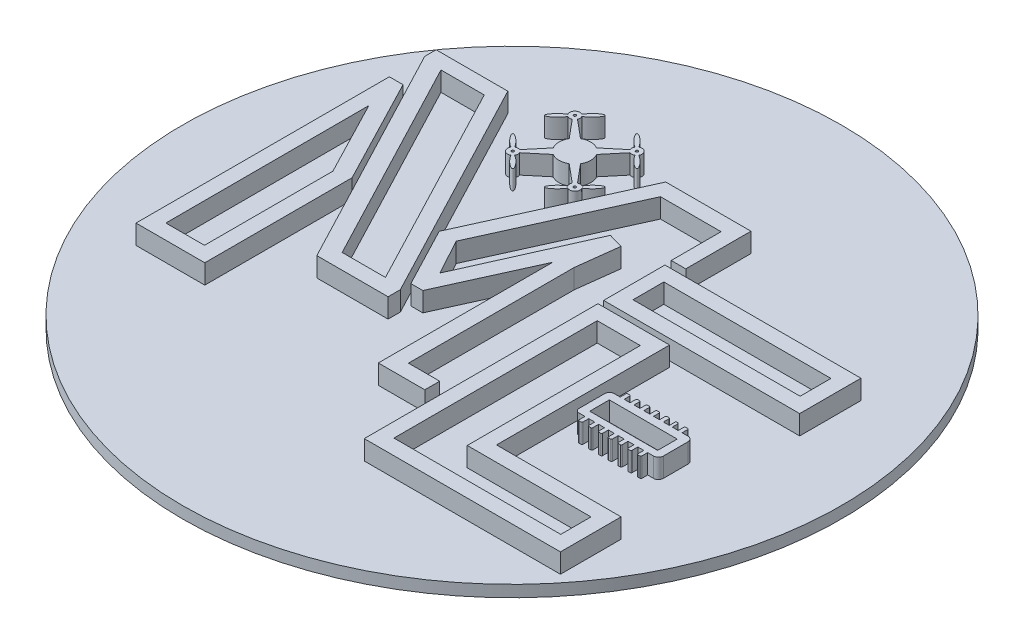
from build123d import *

# Parameters (mm, degrees)
BOSS_EXTRU_1_DEPTH   = 5
BOSS_EXTRU_1_2_DEPTH = 5
BOSS_EXTRU_1_3_DEPTH = 5
ESQUISSE1_W          = 50.560648029
ESQUISSE1_H          = 15.800345487
ESQUISSE1_W_2        = 43.100909758
ESQUISSE1_H_2        = 7.955199737
BOSS_EXTRU_1_4_DEPTH = 5
BOSS_EXTRU_1_5_DEPTH = 5
ESQUISSE1_W_3        = 17.508457207
ESQUISSE1_H_3        = 5.055398907
BOSS_EXTRU_1_6_DEPTH = 5
ESQUISSE1_R          = 0.315517755
BOSS_EXTRU_1_7_DEPTH = 5
ESQUISSE3_R          = 85
BOSS_EXTRU_2_DEPTH   = 3


with BuildPart() as part:
    # Esquisse1 → Boss.-Extru.1 (new body)
    with BuildSketch(Plane(origin=(0, 0, 0), x_dir=(1, 0, 0), z_dir=(0, 1, 0))):
        Polygon((29.256924641, 88.488224229), (29.256924641, 23.141526957), (46.999534199, 23.141526957), (46.999534199, 61.135596962), (32.790865442, 88.488224229), align=None)
        Polygon((43.060766298, 26.998132851), (33.098017175, 26.998132851), (33.048563983, 79.395466689), (43.060766298, 60.121314919), align=None, mode=Mode.SUBTRACT)
    extrude(amount=BOSS_EXTRU_1_DEPTH)



with BuildPart() as body_2:
    # Esquisse1 → Boss.-Extru.1 2 (new body)
    with BuildSketch(Plane(origin=(0, 0, 0), x_dir=(1, 0, 0), z_dir=(0, 1, 0))):
        Polygon((59.849142682, 39.190524629), (78.227373798, 39.190524629), (78.227373798, 42.352829033), (47.753820034, 100.551158448), (29.256924641, 100.551158448), (29.256924641, 97.615478834), align=None)
        Polygon((73.571878916, 43.161959895), (62.404704291, 43.161959895), (34.389209135, 96.665894108), (45.55638376, 96.665894108), align=None, mode=Mode.SUBTRACT)
    extrude(amount=BOSS_EXTRU_1_2_DEPTH)


with BuildPart() as body_3:
    # Esquisse1 → Boss.-Extru.1 3 (new body)
    with BuildSketch(Plane(origin=(0, 0, 0), x_dir=(1, 0, 0), z_dir=(0, 1, 0))):
        Polygon((103.747640967, 23.141526957), (103.747640967, 26.985159963), (95.687289095, 26.985159963), (95.687289095, 69.743892167), (97.014779748, 80.475288943), (93.181344518, 81.574510482), (79.611141982, 51.156262944), (74.598947374, 60.399419438), (91.006209559, 96.665894108), (106.638752662, 96.665894108), (106.638752662, 83.80845443), (110.383474711, 83.80845443), (110.383474711, 100.627631467), (88.407550675, 100.627631467), (70.196980287, 60.399419438), (78.227373798, 45.062990662), (81.316864883, 45.062990662), (91.755502739, 68.122550468), (91.755502739, 23.141526957), align=None)
    extrude(amount=BOSS_EXTRU_1_3_DEPTH)


with BuildPart() as body_4:
    # Esquisse1 → Boss.-Extru.1 4 (new body)
    with BuildSketch(Plane(origin=(0, 0, 0), x_dir=(1, 0, 0), z_dir=(0, 1, 0))):
        with Locations((132.122662307, 74.073085392)):
            Rectangle(ESQUISSE1_W, ESQUISSE1_H)
        with Locations((132.033240508, 74.082470163)):
            Rectangle(ESQUISSE1_W_2, ESQUISSE1_H_2, mode=Mode.SUBTRACT)
    extrude(amount=BOSS_EXTRU_1_4_DEPTH)


with BuildPart() as body_5:
    # Esquisse1 → Boss.-Extru.1 5 (new body)
    with BuildSketch(Plane(origin=(0, 0, 0), x_dir=(1, 0, 0), z_dir=(0, 1, 0))):
        Polygon((125.309732803, 64.710484386), (106.842338292, 64.710484386), (106.842338292, 4.42923495), (157.441506052, 4.42923495), (157.441506052, 20.072280651), (125.309732803, 20.072280651), align=None)
        Polygon((110.546888438, 8.37585045), (110.546888438, 60.81278181), (121.652727478, 60.81278181), (121.652727478, 16.182801074), (153.573020483, 16.182801074), (153.573020483, 8.37585045), align=None, mode=Mode.SUBTRACT)
    extrude(amount=BOSS_EXTRU_1_5_DEPTH)


with BuildPart() as body_6:
    # Esquisse1 → Boss.-Extru.1 6 (new body)
    with BuildSketch(Plane(origin=(0, 0, 0), x_dir=(1, 0, 0), z_dir=(0, 1, 0))):
        with BuildLine():
            Line((127.8, 45.472053479), (127.8, 38.848105631))
            ThreePointArc((127.8, 38.848105631), (128.092893219, 38.14099885), (128.8, 37.848105631))
            Line((128.8, 37.848105631), (130.33125, 37.848105631))
            Line((130.33125, 37.848105631), (130.33125, 36.359959009))
            ThreePointArc((130.33125, 36.359959009), (130.404473305, 36.183182314), (130.58125, 36.109959009))
            Line((130.58125, 36.109959009), (131.08125, 36.109959009))
            ThreePointArc((131.08125, 36.109959009), (131.258026695, 36.183182314), (131.33125, 36.359959009))
            Line((131.33125, 36.359959009), (131.33125, 37.848105631))
            Line((131.33125, 37.848105631), (132.8625, 37.848105631))
            Line((132.8625, 37.848105631), (132.8625, 36.359959009))
            ThreePointArc((132.8625, 36.359959009), (132.935723305, 36.183182314), (133.1125, 36.109959009))
            Line((133.1125, 36.109959009), (133.6125, 36.109959009))
            ThreePointArc((133.6125, 36.109959009), (133.789276695, 36.183182314), (133.8625, 36.359959009))
            Line((133.8625, 36.359959009), (133.8625, 37.848105631))
            Line((133.8625, 37.848105631), (135.39375, 37.848105631))
            Line((135.39375, 37.848105631), (135.39375, 36.359959009))
            ThreePointArc((135.39375, 36.359959009), (135.466973305, 36.183182314), (135.64375, 36.109959009))
            Line((135.64375, 36.109959009), (136.14375, 36.109959009))
            ThreePointArc((136.14375, 36.109959009), (136.320526695, 36.183182314), (136.39375, 36.359959009))
            Line((136.39375, 36.359959009), (136.39375, 37.848105631))
            Line((136.39375, 37.848105631), (137.925, 37.848105631))
            Line((137.925, 37.848105631), (137.925, 36.359959009))
            ThreePointArc((137.925, 36.359959009), (137.998223305, 36.183182314), (138.175, 36.109959009))
            Line((138.175, 36.109959009), (138.675, 36.109959009))
            ThreePointArc((138.675, 36.109959009), (138.851776695, 36.183182314), (138.925, 36.359959009))
            Line((138.925, 36.359959009), (138.925, 37.848105631))
            Line((138.925, 37.848105631), (140.45625, 37.848105631))
            Line((140.45625, 37.848105631), (140.45625, 36.359959009))
            ThreePointArc((140.45625, 36.359959009), (140.529473305, 36.183182314), (140.70625, 36.109959009))
            Line((140.70625, 36.109959009), (141.20625, 36.109959009))
            ThreePointArc((141.20625, 36.109959009), (141.383026695, 36.183182314), (141.45625, 36.359959009))
            Line((141.45625, 36.359959009), (141.45625, 37.848105631))
            Line((141.45625, 37.848105631), (142.9875, 37.848105631))
            Line((142.9875, 37.848105631), (142.9875, 36.359959009))
            ThreePointArc((142.9875, 36.359959009), (143.060723305, 36.183182314), (143.2375, 36.109959009))
            Line((143.2375, 36.109959009), (143.7375, 36.109959009))
            ThreePointArc((143.7375, 36.109959009), (143.914276695, 36.183182314), (143.9875, 36.359959009))
            Line((143.9875, 36.359959009), (143.9875, 37.848105631))
            Line((143.9875, 37.848105631), (145.51875, 37.848105631))
            Line((145.51875, 37.848105631), (145.51875, 36.359959009))
            ThreePointArc((145.51875, 36.359959009), (145.591973305, 36.183182314), (145.76875, 36.109959009))
            Line((145.76875, 36.109959009), (146.26875, 36.109959009))
            ThreePointArc((146.26875, 36.109959009), (146.445526695, 36.183182314), (146.51875, 36.359959009))
            Line((146.51875, 36.359959009), (146.51875, 37.848105631))
            Line((146.51875, 37.848105631), (148.05, 37.848105631))
            ThreePointArc((148.05, 37.848105631), (148.933883476, 38.214222155), (149.3, 39.098105631))
            Line((149.3, 39.098105631), (149.3, 45.472053479))
            ThreePointArc((149.3, 45.472053479), (148.933883476, 46.355936956), (148.05, 46.722053479))
            Line((148.05, 46.722053479), (146.51875, 46.722053479))
            Line((146.51875, 46.722053479), (146.51875, 48.160180878))
            ThreePointArc((146.51875, 48.160180878), (146.445526695, 48.336957574), (146.26875, 48.410180878))
            Line((146.26875, 48.410180878), (145.76875, 48.410180878))
            ThreePointArc((145.76875, 48.410180878), (145.591973305, 48.336957574), (145.51875, 48.160180878))
            Line((145.51875, 48.160180878), (145.51875, 46.722053479))
            Line((145.51875, 46.722053479), (143.9875, 46.722053479))
            Line((143.9875, 46.722053479), (143.9875, 48.160180878))
            ThreePointArc((143.9875, 48.160180878), (143.914276695, 48.336957574), (143.7375, 48.410180878))
            Line((143.7375, 48.410180878), (143.2375, 48.410180878))
            Line((143.2375, 48.410180878), (143.2375, 46.722053479))
            Line((143.2375, 46.722053479), (141.70625, 46.722053479))
            Line((141.70625, 46.722053479), (141.70625, 48.160180878))
            ThreePointArc((141.70625, 48.160180878), (141.633026695, 48.336957574), (141.45625, 48.410180878))
            Line((141.45625, 48.410180878), (140.95625, 48.410180878))
            ThreePointArc((140.95625, 48.410180878), (140.779473305, 48.336957574), (140.70625, 48.160180878))
            Line((140.70625, 48.160180878), (140.70625, 46.722053479))
            Line((140.70625, 46.722053479), (139.175, 46.722053479))
            Line((139.175, 46.722053479), (139.175, 48.160180878))
            ThreePointArc((139.175, 48.160180878), (139.101776695, 48.336957574), (138.925, 48.410180878))
            Line((138.925, 48.410180878), (138.425, 48.410180878))
            ThreePointArc((138.425, 48.410180878), (138.248223305, 48.336957574), (138.175, 48.160180878))
            Line((138.175, 48.160180878), (138.175, 46.722053479))
            Line((138.175, 46.722053479), (136.64375, 46.722053479))
            Line((136.64375, 46.722053479), (136.64375, 48.160180878))
            ThreePointArc((136.64375, 48.160180878), (136.570526695, 48.336957574), (136.39375, 48.410180878))
            Line((136.39375, 48.410180878), (135.89375, 48.410180878))
            ThreePointArc((135.89375, 48.410180878), (135.716973305, 48.336957574), (135.64375, 48.160180878))
            Line((135.64375, 48.160180878), (135.64375, 46.722053479))
            Line((135.64375, 46.722053479), (134.1125, 46.722053479))
            Line((134.1125, 46.722053479), (134.1125, 48.160180878))
            ThreePointArc((134.1125, 48.160180878), (134.039276695, 48.336957574), (133.8625, 48.410180878))
            Line((133.8625, 48.410180878), (133.3625, 48.410180878))
            ThreePointArc((133.3625, 48.410180878), (133.185723305, 48.336957574), (133.1125, 48.160180878))
            Line((133.1125, 48.160180878), (133.1125, 46.722053479))
            Line((133.1125, 46.722053479), (131.58125, 46.722053479))
            Line((131.58125, 46.722053479), (131.58125, 48.160180878))
            ThreePointArc((131.58125, 48.160180878), (131.508026695, 48.336957574), (131.33125, 48.410180878))
            Line((131.33125, 48.410180878), (130.83125, 48.410180878))
            ThreePointArc((130.83125, 48.410180878), (130.654473305, 48.336957574), (130.58125, 48.160180878))
            Line((130.58125, 48.160180878), (130.58125, 46.722053479))
            Line((130.58125, 46.722053479), (129.05, 46.722053479))
            ThreePointArc((129.05, 46.722053479), (128.166116524, 46.355936956), (127.8, 45.472053479))
        make_face()
        with Locations((138.553357621, 42.159300602)):
            Rectangle(ESQUISSE1_W_3, ESQUISSE1_H_3, mode=Mode.SUBTRACT)
    extrude(amount=BOSS_EXTRU_1_6_DEPTH)


with BuildPart() as body_7:
    # Esquisse1 → Boss.-Extru.1 7 (new body)
    with BuildSketch(Plane(origin=(0, 0, 0), x_dir=(1, 0, 0), z_dir=(0, 1, 0))):
        with BuildLine():
            Line((66.271316449, 93.726360211), (62.33253729, 89.008279071))
            ThreePointArc((62.33253729, 89.008279071), (61.716549431, 89.118763092), (61.118015351, 88.935993522))
            add(Edge.make_bspline(
                [(61.118015351, 88.935993522), (59.125261647, 92.94494394), (57.882012705, 91.701694997)],
                knots=[3.766772284, 3.766772284, 3.766772284, 6.283185307, 6.283185307, 6.283185307], degree=2, weights=[1, 0.307523979, 1]))
            add(Edge.make_bspline(
                [(57.882012705, 91.701694997), (56.639082612, 90.458764905), (60.647519656, 88.465789057)],
                knots=[0, 0, 0, 2.516262894, 2.516262894, 2.516262894], degree=2, weights=[1, 0.307595405, 1]))
            ThreePointArc((60.647519656, 88.465789057), (60.852911859, 86.845107008), (62.473593908, 86.639714805))
            add(Edge.make_bspline(
                [(62.473593908, 86.639714805), (64.466569756, 82.631277761), (65.709499849, 83.874207853)],
                knots=[3.766922413, 3.766922413, 3.766922413, 6.283185307, 6.283185307, 6.283185307], degree=2, weights=[1, 0.307595405, 1]))
            add(Edge.make_bspline(
                [(65.709499849, 83.874207853), (66.952748791, 85.117456796), (62.943798373, 87.110210499)],
                knots=[0, 0, 0, 2.516413023, 2.516413023, 2.516413023], degree=2, weights=[1, 0.307523979, 1]))
            ThreePointArc((62.943798373, 87.110210499), (63.126567944, 87.70874458), (63.016083922, 88.324732438))
            Line((63.016083922, 88.324732438), (67.734165063, 92.263511597))
            ThreePointArc((67.734165063, 92.263511597), (69.8, 91.703273336), (71.865834937, 92.263511597))
            Line((71.865834937, 92.263511597), (76.583916078, 88.324732438))
            ThreePointArc((76.583916078, 88.324732438), (76.473432056, 87.70874458), (76.656201627, 87.110210499))
            add(Edge.make_bspline(
                [(76.656201627, 87.110210499), (72.647251209, 85.117456796), (73.890500151, 83.874207853)],
                knots=[3.766772284, 3.766772284, 3.766772284, 6.283185307, 6.283185307, 6.283185307], degree=2, weights=[1, 0.307523979, 1]))
            add(Edge.make_bspline(
                [(73.890500151, 83.874207853), (75.133430244, 82.631277761), (77.126406092, 86.639714805)],
                knots=[0, 0, 0, 2.516262894, 2.516262894, 2.516262894], degree=2, weights=[1, 0.307595405, 1]))
            ThreePointArc((77.126406092, 86.639714805), (78.747088141, 86.845107008), (78.952480344, 88.465789057))
            add(Edge.make_bspline(
                [(78.952480344, 88.465789057), (82.960917388, 90.458764905), (81.717987295, 91.701694997)],
                knots=[3.766922413, 3.766922413, 3.766922413, 6.283185307, 6.283185307, 6.283185307], degree=2, weights=[1, 0.307595405, 1]))
            add(Edge.make_bspline(
                [(81.717987295, 91.701694997), (80.474738353, 92.94494394), (78.481984649, 88.935993522)],
                knots=[0, 0, 0, 2.516413023, 2.516413023, 2.516413023], degree=2, weights=[1, 0.307523979, 1]))
            ThreePointArc((78.481984649, 88.935993522), (77.883450569, 89.118763092), (77.26746271, 89.008279071))
            Line((77.26746271, 89.008279071), (73.328683551, 93.726360211))
            ThreePointArc((73.328683551, 93.726360211), (73.888921813, 95.792195148), (73.328683551, 97.858030086))
            Line((73.328683551, 97.858030086), (77.26746271, 102.576111226))
            ThreePointArc((77.26746271, 102.576111226), (77.883450569, 102.465627204), (78.481984649, 102.648396775))
            add(Edge.make_bspline(
                [(78.481984649, 102.648396775), (80.474738353, 98.639446357), (81.717987295, 99.882695299)],
                knots=[3.766772284, 3.766772284, 3.766772284, 6.283185307, 6.283185307, 6.283185307], degree=2, weights=[1, 0.307523979, 1]))
            add(Edge.make_bspline(
                [(81.717987295, 99.882695299), (82.960917388, 101.125625392), (78.952480344, 103.11860124)],
                knots=[0, 0, 0, 2.516262894, 2.516262894, 2.516262894], degree=2, weights=[1, 0.307595405, 1]))
            ThreePointArc((78.952480344, 103.11860124), (78.747088141, 104.739283289), (77.126406092, 104.944675492))
            add(Edge.make_bspline(
                [(77.126406092, 104.944675492), (75.133430244, 108.953112536), (73.890500151, 107.710182443)],
                knots=[3.766922413, 3.766922413, 3.766922413, 6.283185307, 6.283185307, 6.283185307], degree=2, weights=[1, 0.307595405, 1]))
            add(Edge.make_bspline(
                [(73.890500151, 107.710182443), (72.647251209, 106.466933501), (76.656201627, 104.474179798)],
                knots=[0, 0, 0, 2.516413023, 2.516413023, 2.516413023], degree=2, weights=[1, 0.307523979, 1]))
            ThreePointArc((76.656201627, 104.474179798), (76.473432056, 103.875645717), (76.583916078, 103.259657859))
            Line((76.583916078, 103.259657859), (71.865834937, 99.3208787))
            ThreePointArc((71.865834937, 99.3208787), (69.8, 99.881116961), (67.734165063, 99.3208787))
            Line((67.734165063, 99.3208787), (63.016083922, 103.259657859))
            ThreePointArc((63.016083922, 103.259657859), (63.126567944, 103.875645717), (62.943798373, 104.474179798))
            add(Edge.make_bspline(
                [(62.943798373, 104.474179798), (66.952234654, 106.466677936), (65.709530005, 107.710152278), (64.466825356, 108.953626619), (62.473593908, 104.944675492)],
                knots=[0.62517963, 0.62517963, 0.62517963, 3.141517589, 3.141517589, 5.657855548, 5.657855548, 5.657855548], degree=2, weights=[1, 0.307559692, 1, 0.307559692, 1]))
            ThreePointArc((62.473593908, 104.944675492), (60.852911859, 104.739283289), (60.647519656, 103.11860124))
            add(Edge.make_bspline(
                [(60.647519656, 103.11860124), (56.638568529, 101.125369792), (57.882042871, 99.882665143), (59.125517212, 98.639960494), (61.118015351, 102.648396775)],
                knots=[0.625329759, 0.625329759, 0.625329759, 3.141667718, 3.141667718, 5.658005677, 5.658005677, 5.658005677], degree=2, weights=[1, 0.307559692, 1, 0.307559692, 1]))
            ThreePointArc((61.118015351, 102.648396775), (61.716549431, 102.465627204), (62.33253729, 102.576111226))
            Line((62.33253729, 102.576111226), (66.271316449, 97.858030086))
            ThreePointArc((66.271316449, 97.858030086), (65.711078187, 95.792195148), (66.271316449, 93.726360211))
        make_face()
        with Locations(Location((61.795756277, 87.787951425, 0), (0, 0, 270))):
            Circle(ESQUISSE1_R, mode=Mode.SUBTRACT)
        with Locations(Location((77.804243723, 87.787951425, 0), (0, 0, 270))):
            Circle(ESQUISSE1_R, mode=Mode.SUBTRACT)
        with Locations(Location((61.795756277, 103.796438871, 0), (0, 0, 270))):
            Circle(ESQUISSE1_R, mode=Mode.SUBTRACT)
        with Locations(Location((77.804243723, 103.796438871, 0), (0, 0, 270))):
            Circle(ESQUISSE1_R, mode=Mode.SUBTRACT)
    extrude(amount=BOSS_EXTRU_1_7_DEPTH)


with BuildPart() as part_1:
    add(part.part)

    add(body_2.part)  # Boss.-Extru.2 merges body 2

    add(body_3.part)  # Boss.-Extru.2 merges body 3

    add(body_4.part)  # Boss.-Extru.2 merges body 4

    add(body_5.part)  # Boss.-Extru.2 merges body 5

    add(body_6.part)  # Boss.-Extru.2 merges body 6

    add(body_7.part)  # Boss.-Extru.2 merges body 7
    # Esquisse3 → Boss.-Extru.2 (add)
    with BuildSketch(Plane.XZ):
        with Locations(Location((93.349215347, -56.028744788, 0), (0, 0, 270))):
            Circle(ESQUISSE3_R)
    extrude(amount=BOSS_EXTRU_2_DEPTH)


solid = part_1.part
